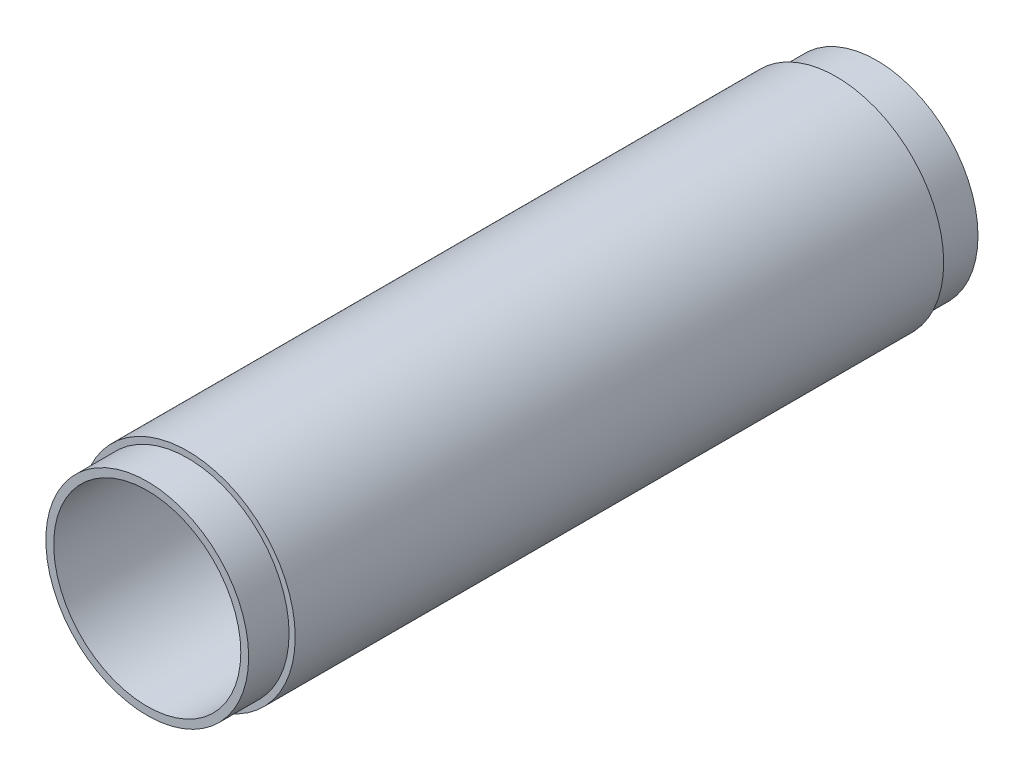
from build123d import *


with BuildPart() as part:
    # Sketch1 → Revolve1 (revolve)
    with BuildSketch(Plane(origin=(0, 0, 0), x_dir=(0, 0, -1), z_dir=(1, 0, 0)), mode=Mode.PRIVATE) as revolve1_sk:
        Polygon((0, 11.049), (86.1441, 11.049), (86.1441, 11.9761), (81.3689, 11.9761), (81.3689, 12.7), (4.7752, 12.7), (4.7752, 11.9761), (0, 11.9761), align=None)
    revolve(revolve1_sk.sketch.rotate(Axis((0, 0, -14.106738772), (0, 0, -1)), 90), axis=Axis((0, 0, -14.106738772), (0, 0, -1)))


solid = part.part
